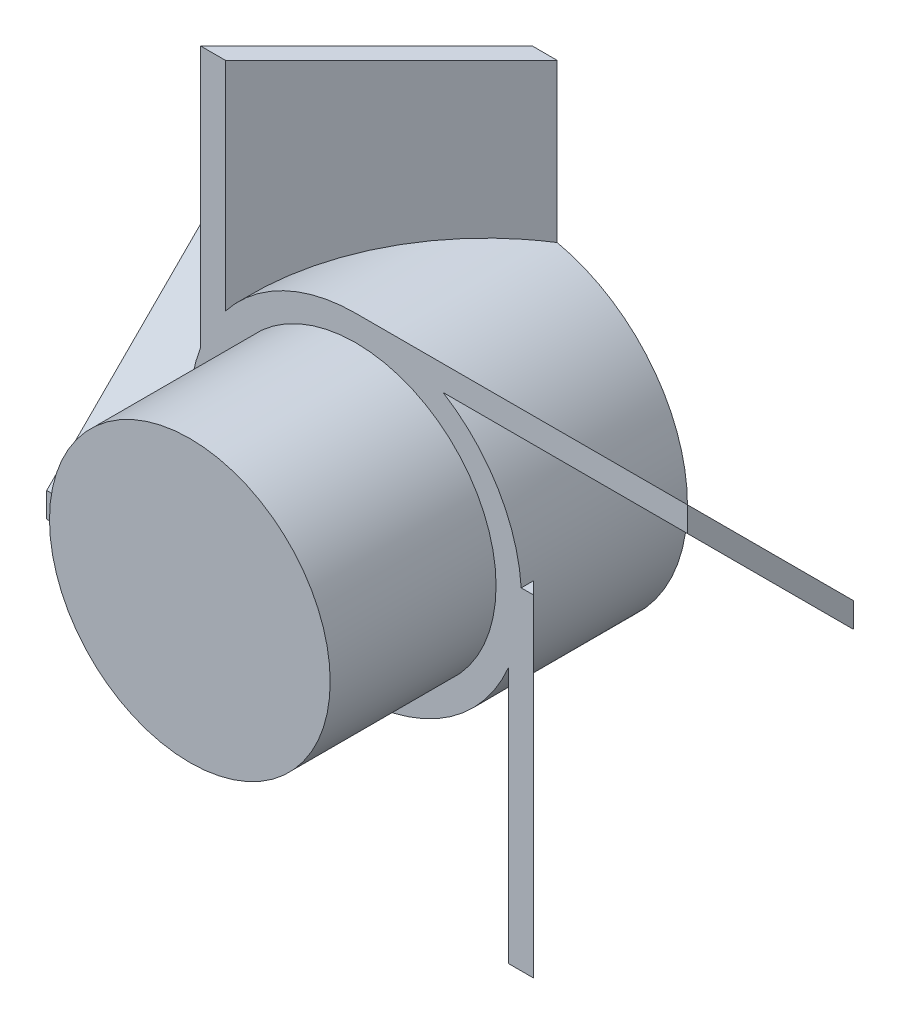
from build123d import *

# Parameters (mm, degrees)
SKETCH1_R           = 20
SKETCH1_R_2         = 10
BOSS_EXTRUDE1_DEPTH = 10
SKETCH5_R           = 16.925
BOSS_EXTRUDE2_DEPTH = 20
BOSS_EXTRUDE3_DEPTH = 40
CIRPATTERN1_COUNT   = 4


with BuildPart() as part:
    # Sketch1 → Boss-Extrude1 (new, symmetric)
    with BuildSketch(Plane.XY):
        Circle(SKETCH1_R)
        Circle(SKETCH1_R_2, mode=Mode.SUBTRACT)
    extrude(amount=BOSS_EXTRUDE1_DEPTH, both=True)

    # Sketch5 → Boss-Extrude2 (add, symmetric)
    with BuildSketch(Plane.XY.offset(10)):
        Circle(SKETCH5_R)
    extrude(amount=BOSS_EXTRUDE2_DEPTH, both=True)

    # Sketch6 → Boss-Extrude3 (add)
    with BuildSketch(Plane(origin=(0, 0, 0), x_dir=(0, 0, -1), z_dir=(1, 0, 0))):
        Polygon((10, 0), (-10, 20), (-10, 17), (10, -3), align=None)
    boss_extrude3 = extrude(amount=BOSS_EXTRUDE3_DEPTH)

    # CirPattern1: Boss-Extrude3 ×4 about axis
    cirpattern1_axis = Axis((1.370302178, -0.068730139, 0), (0, 0, 1))
    for i in range(1, CIRPATTERN1_COUNT):
        add(boss_extrude3.rotate(cirpattern1_axis, i * 360 / CIRPATTERN1_COUNT))


solid = part.part
